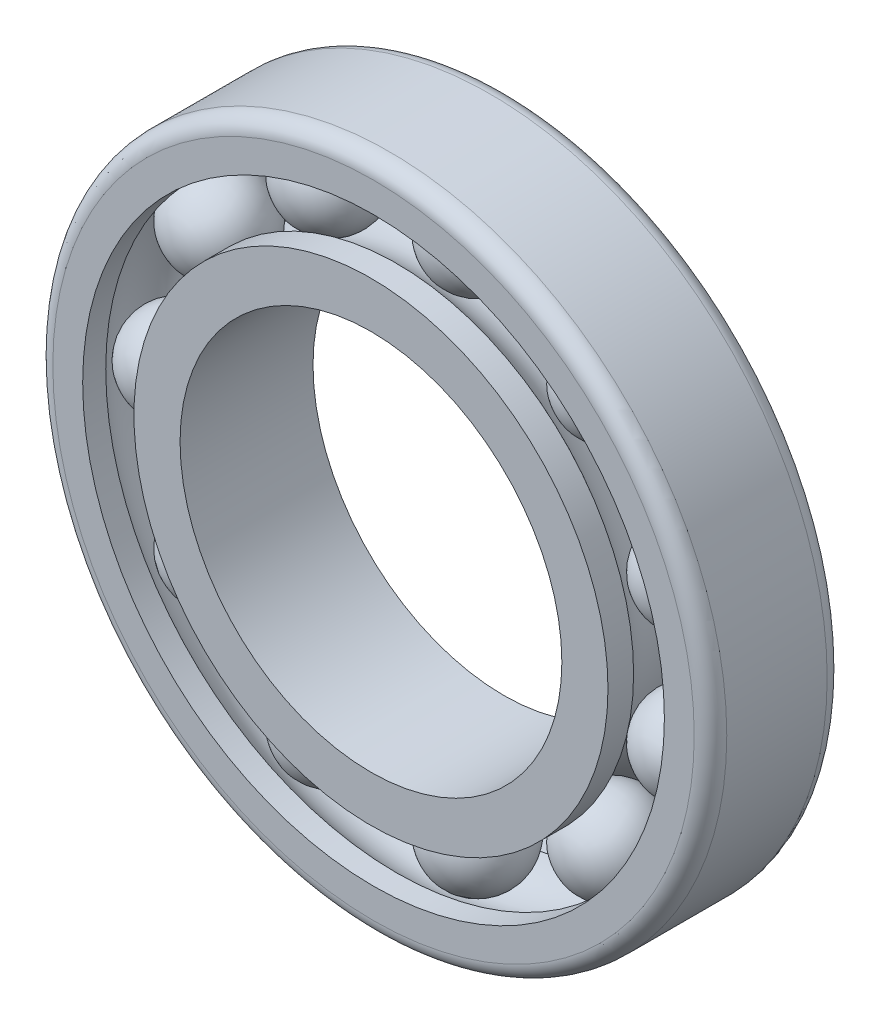
from build123d import *

# Parameters (mm, degrees)
MATRIZC1_COUNT = 11
REDONDEO1_R    = 3


with BuildPart() as part:
    # Croquis2 → Revolución1 (revolve)
    with BuildSketch(Plane(origin=(0, 0, 0), x_dir=(1, 0, 0), z_dir=(0, 1, 0))):
        with BuildLine():
            Line((-48.375, -8.52763673), (-48.375, 8.52763673))
            ThreePointArc((-48.375, 8.52763673), (-39.84736327, 0), (-48.375, -8.52763673))
        make_face()
    revolve(axis=Axis((-48.375, 0, 8.52763673), (0, 0, -1)))


with BuildPart() as body_2:
    # Croquis1 → Revolución2 (revolve)
    with BuildSketch(Plane(origin=(0, 0, 0), x_dir=(1, 0, 0), z_dir=(0, 1, 0)), mode=Mode.PRIVATE) as revoluci_n2_sk:
        with BuildLine():
            Line((-62.1, 12.25), (-53.6, 12.25))
            Line((-53.6, 12.25), (-53.6, 7.527398305))
            ThreePointArc((-53.6, 7.527398305), (-57.853036533, -0.236520947), (-53.6, -8.0004402))
            Line((-53.6, -8.0004402), (-53.6, -12.25))
            Line((-53.6, -12.25), (-62.1, -12.25))
            Line((-62.1, -12.25), (-62.1, 12.25))
        make_face()
        with BuildLine():
            Line((-43.68, 11.776958106), (-35.18, 11.776958106))
            Line((-35.18, 11.776958106), (-35.18, -12.723041894))
            Line((-35.18, -12.723041894), (-43.68, -12.723041894))
            Line((-43.68, -12.723041894), (-43.68, -8.0004402))
            ThreePointArc((-43.68, -8.0004402), (-39.426963467, -0.236520947), (-43.68, 7.527398305))
            Line((-43.68, 7.527398305), (-43.68, 11.541533237))
            Line((-43.68, 11.541533237), (-43.68, 11.776958106))
        make_face()
    revolve(revoluci_n2_sk.sketch.rotate(Axis((0, 0, 0), (0, 0, -1)), 180), axis=Axis((0, 0, 0), (0, 0, -1)))

    # Redondeo1
    redondeo1_edges = [body_2.edges().sort_by_distance(p)[0] for p in [
        (-62.1, 0, 12.25),
        (-62.1, 0, -12.25),
    ]]
    fillet(redondeo1_edges, radius=REDONDEO1_R)


with BuildPart() as matrizc1_1:
    # MatrizC1: pattern copy
    add(part.part.rotate(Axis((0, 0, 0), (0, 0, 1)), 1 * 360 / MATRIZC1_COUNT))


with BuildPart() as matrizc1_2:
    # MatrizC1: pattern copy
    add(part.part.rotate(Axis((0, 0, 0), (0, 0, 1)), 2 * 360 / MATRIZC1_COUNT))


with BuildPart() as matrizc1_3:
    # MatrizC1: pattern copy
    add(part.part.rotate(Axis((0, 0, 0), (0, 0, 1)), 3 * 360 / MATRIZC1_COUNT))


with BuildPart() as matrizc1_4:
    # MatrizC1: pattern copy
    add(part.part.rotate(Axis((0, 0, 0), (0, 0, 1)), 4 * 360 / MATRIZC1_COUNT))


with BuildPart() as matrizc1_5:
    # MatrizC1: pattern copy
    add(part.part.rotate(Axis((0, 0, 0), (0, 0, 1)), 5 * 360 / MATRIZC1_COUNT))


with BuildPart() as matrizc1_6:
    # MatrizC1: pattern copy
    add(part.part.rotate(Axis((0, 0, 0), (0, 0, 1)), 6 * 360 / MATRIZC1_COUNT))


with BuildPart() as matrizc1_7:
    # MatrizC1: pattern copy
    add(part.part.rotate(Axis((0, 0, 0), (0, 0, 1)), 7 * 360 / MATRIZC1_COUNT))


with BuildPart() as matrizc1_8:
    # MatrizC1: pattern copy
    add(part.part.rotate(Axis((0, 0, 0), (0, 0, 1)), 8 * 360 / MATRIZC1_COUNT))


with BuildPart() as matrizc1_9:
    # MatrizC1: pattern copy
    add(part.part.rotate(Axis((0, 0, 0), (0, 0, 1)), 9 * 360 / MATRIZC1_COUNT))


with BuildPart() as matrizc1_10:
    # MatrizC1: pattern copy
    add(part.part.rotate(Axis((0, 0, 0), (0, 0, 1)), 10 * 360 / MATRIZC1_COUNT))


solid = Compound([part.part, body_2.part, matrizc1_1.part, matrizc1_2.part, matrizc1_3.part, matrizc1_4.part, matrizc1_5.part, matrizc1_6.part, matrizc1_7.part, matrizc1_8.part, matrizc1_9.part, matrizc1_10.part])
